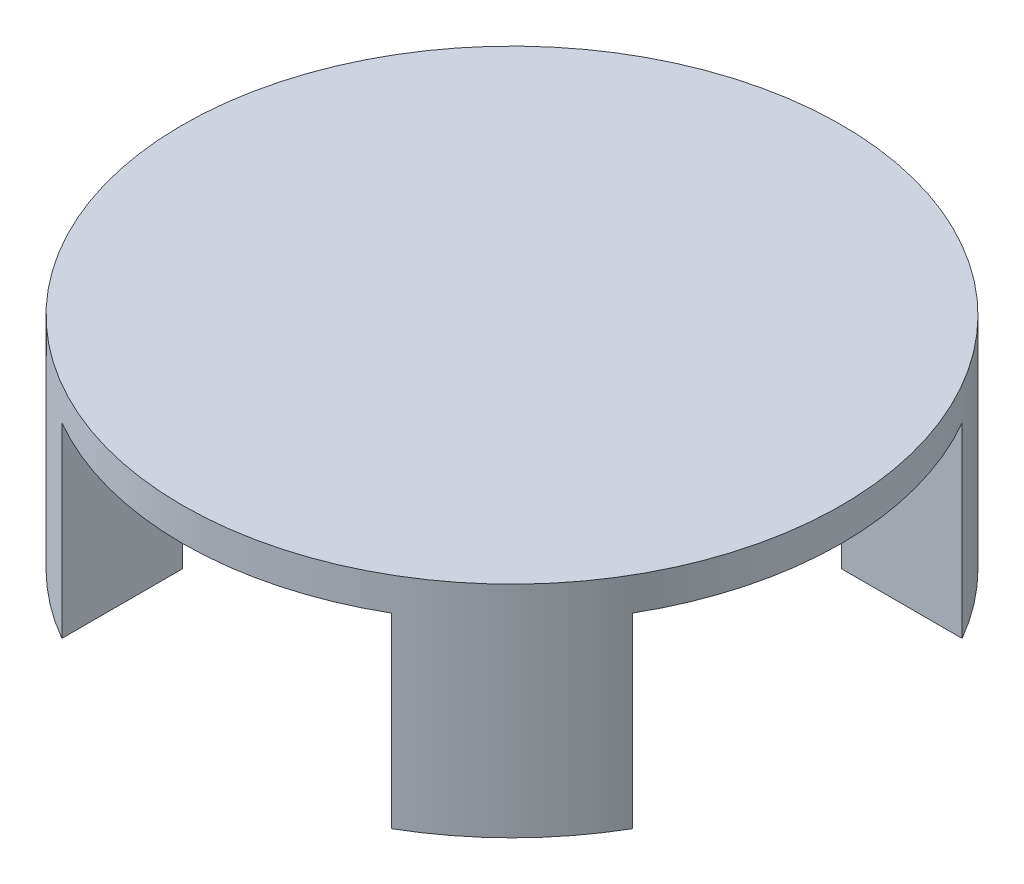
from build123d import *

# Parameters (mm, degrees)
CROQUIS1_R                 = 30
SALIENTE_EXTRUIR1_DEPTH    = 20
CORTAR_EXTRUIR1_DEPTH      = 47.904157598
CORTAR_EXTRUIR1_DEPTH_BACK = 47.904157598
CROQUIS2_W                 = 30
CROQUIS2_H                 = 17
CORTAR_EXTRUIR2_DEPTH      = 47.904157598
CORTAR_EXTRUIR2_DEPTH_BACK = 47.904157598
CROQUIS3_W                 = 30
CROQUIS3_H                 = 17


with BuildPart() as part:
    # Croquis1 → Saliente-Extruir1 (new body)
    with BuildSketch(Plane(origin=(0, 0, 0), x_dir=(1, 0, 0), z_dir=(0, 1, 0))):
        with Locations(Location((0, 0, 0), (0, 0, 270))):
            Circle(CROQUIS1_R)
    extrude(amount=SALIENTE_EXTRUIR1_DEPTH)

    # Croquis2 → Cortar-Extruir1 (cut, two sides: drawn at the far end of the back side and taken through both)
    with BuildSketch(Plane.XY.offset(-CORTAR_EXTRUIR1_DEPTH_BACK)):
        with Locations((0, 8.5)):
            Rectangle(CROQUIS2_W, CROQUIS2_H)
    extrude(amount=CORTAR_EXTRUIR1_DEPTH + CORTAR_EXTRUIR1_DEPTH_BACK, mode=Mode.SUBTRACT)

    # Croquis3 → Cortar-Extruir2 (cut, two sides: drawn at the far end of the back side and taken through both)
    with BuildSketch(Plane(origin=(0, 0, 0), x_dir=(0, 0, -1), z_dir=(1, 0, 0)).offset(-CORTAR_EXTRUIR2_DEPTH_BACK)):
        with Locations((0, 8.5)):
            Rectangle(CROQUIS3_W, CROQUIS3_H)
    extrude(amount=CORTAR_EXTRUIR2_DEPTH + CORTAR_EXTRUIR2_DEPTH_BACK, mode=Mode.SUBTRACT)


solid = part.part
